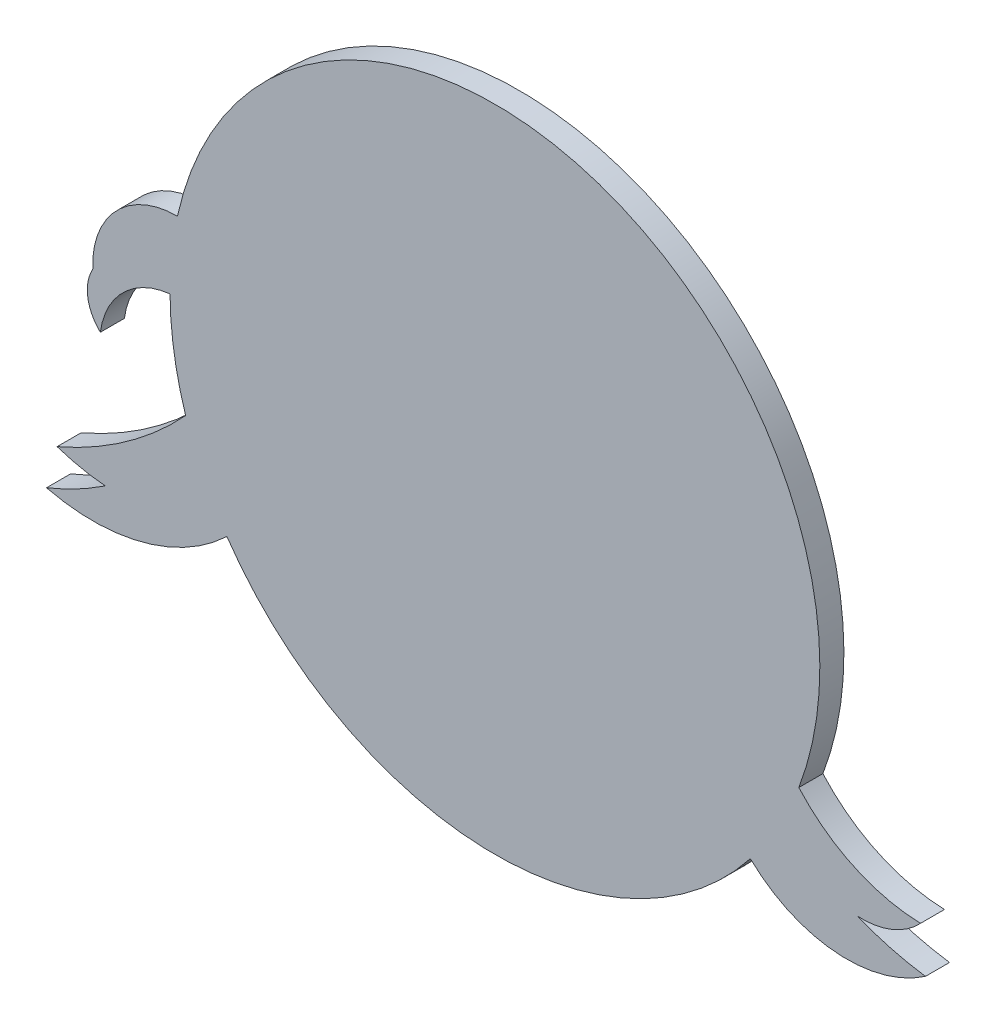
from build123d import *

# Parameters (mm, degrees)
BOSS_EXTRUDE1_DEPTH = 3


with BuildPart() as part:
    # Sketch1 → Boss-Extrude1 (new body)
    with BuildSketch(Plane.XY):
        with BuildLine():
            ThreePointArc((-33.415395542, -22.883647891), (-1.332760204, -40.478065051), (31.837744667, -25.032139631))
            ThreePointArc((31.837744667, -25.032139631), (42.429569674, -29.815081636), (53.66099822, -26.828728675))
            ThreePointArc((53.66099822, -26.828728675), (49.331198922, -25.947152532), (45.137351659, -24.555756259))
            ThreePointArc((45.137351659, -24.555756259), (49.437791518, -23.866847227), (53.038636725, -21.416889589))
            ThreePointArc((53.038636725, -21.416889589), (44.73000771, -19.434385597), (37.879146269, -14.332490292))
            ThreePointArc((37.879146269, -14.332490292), (11.505540341, 38.831334531), (-39.572863934, 8.616173169))
            ThreePointArc((-39.572863934, 8.616173169), (-47.212914381, 5.371433585), (-50.134307409, -2.398004527))
            ThreePointArc((-50.134307409, -2.398004527), (-50.75248884, -5.72327668), (-49.186370781, -8.721085446))
            ThreePointArc((-49.186370781, -8.721085446), (-46.310274165, -2.976393999), (-40.499308481, -0.236669673))
            ThreePointArc((-40.499308481, -0.236669673), (-39.99258879, -6.390840467), (-38.556168915, -12.396444595))
            ThreePointArc((-38.556168915, -12.396444595), (-45.968324298, -18.925044219), (-54.579160775, -23.764068463))
            ThreePointArc((-54.579160775, -23.764068463), (-51.613504277, -24.564074489), (-48.572929157, -25))
            ThreePointArc((-48.572929157, -25), (-52.134064431, -27.12602852), (-55.899902615, -28.863884809))
            ThreePointArc((-55.899902615, -28.863884809), (-43.894548209, -28.742874568), (-33.415395542, -22.883647891))
        make_face()
    extrude(amount=BOSS_EXTRUDE1_DEPTH)


solid = part.part
